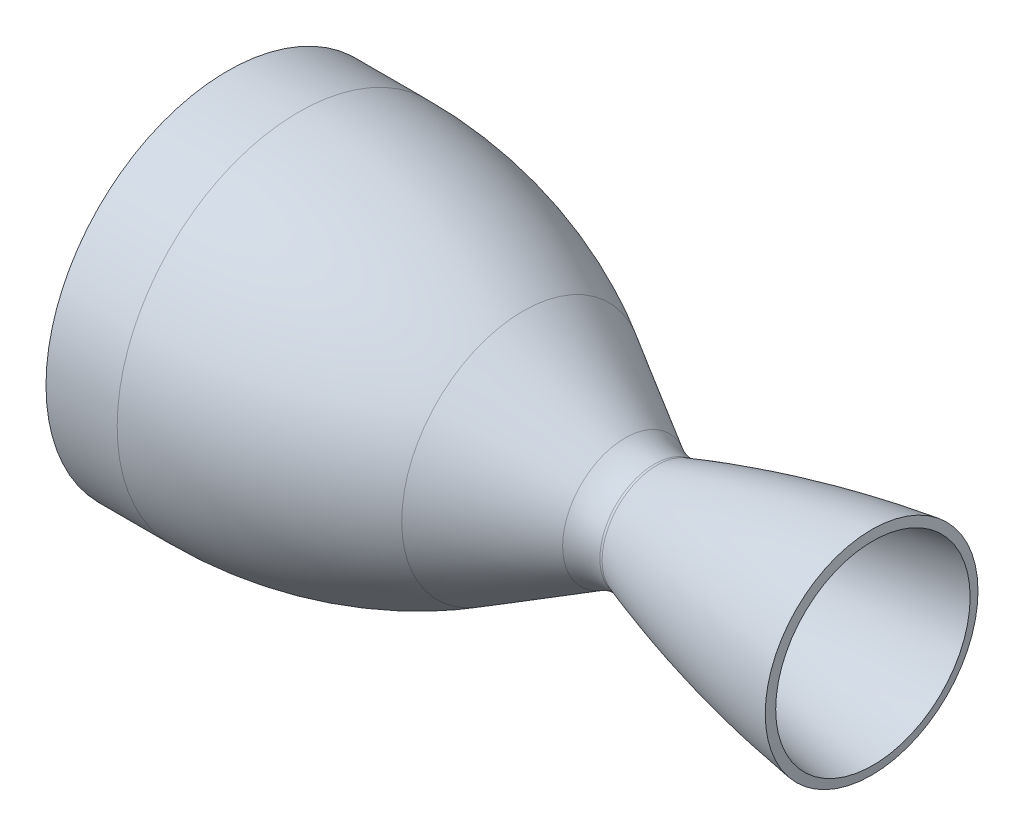
from build123d import *


with BuildPart() as part:
    # Model → Revolve1 (revolve)
    with BuildSketch(Plane.XY, mode=Mode.PRIVATE) as revolve1_sk:
        with BuildLine():
            Line((0, 94.6787794), (39.110731504, 94.6787794))
            ThreePointArc((39.110731504, 94.6787794), (101.637396909, 86.446986704), (159.90297235, 62.312591822))
            Line((159.90297235, 62.312591822), (215.962822425, 29.946417451))
            ThreePointArc((215.962822425, 29.946417451), (224.983711605, 26.209840113), (234.664318334, 24.9353578))
            ThreePointArc((234.664318334, 24.9353578), (236.232163558, 25.0652745), (237.757240536, 25.451483257))
            add(Edge.make_bspline(
                [(237.757240536, 25.451483257), (294.7004774, 45.0004942), (354.679631, 53.4300176)],
                knots=[0, 0, 0, 1, 1, 1], degree=2))
            Line((354.679631, 53.4300176), (353.972631393, 58.460579354))
            add(Edge.make_bspline(
                [(236.107739075, 30.256225178), (293.514278696, 49.963883796), (353.972631393, 58.460579354)],
                knots=[0, 0, 0, 1, 1, 1], degree=2))
            ThreePointArc((236.107739075, 30.256225178), (235.396010426, 30.075987816), (234.664322529, 30.0153578))
            ThreePointArc((234.664322529, 30.0153578), (226.298514539, 31.116742725), (218.50282271, 34.345826338))
            Line((218.50282271, 34.345826338), (162.442972634, 66.712000709))
            ThreePointArc((162.442972634, 66.712000709), (102.952197817, 91.353889859), (39.110731504, 99.7587794))
            Line((39.110731504, 99.7587794), (0, 99.7587794))
            Line((0, 99.7587794), (0, 94.6787794))
        make_face()
    revolve(revolve1_sk.sketch.rotate(Axis((0, 0, 0), (1, 0, 0)), 90), axis=Axis((0, 0, 0), (1, 0, 0)))


solid = part.part
